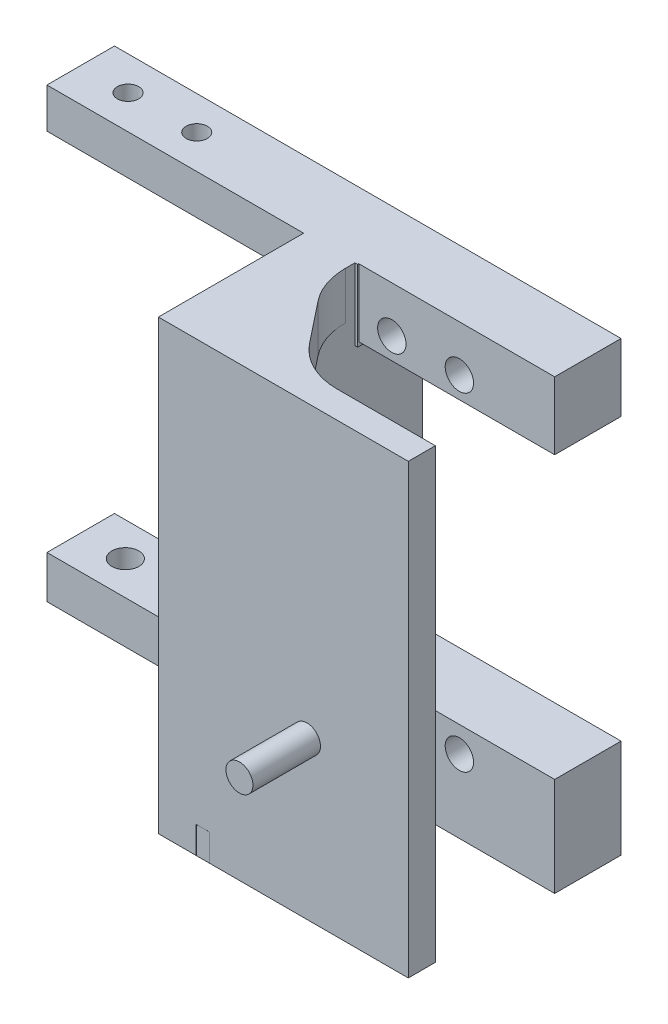
from build123d import *

# Parameters (mm, degrees)
SKETCH3_W               = 5
SKETCH3_H               = 41
SKETCH3_W_2             = 40.6
SKETCH3_H_2             = 5.921911982
SKETCH3_H_3             = 5.716066276
BOSS_EXTRUDE3_DEPTH     = 29.5
SKETCH4_W               = 38
SKETCH4_H               = 19.5
CUT_EXTRUDE1_DEPTH      = 83
SKETCH6_W               = 2
SKETCH6_H               = 62.25
BOSS_EXTRUDE4_DEPTH     = 30
CUT_EXTRUDE3_DEPTH      = 96.683171243
CUT_EXTRUDE3_DEPTH_BACK = 77
SKETCH9_W               = 24.4
SKETCH9_H               = 17.5
SKETCH10_R              = 2
BOSS_EXTRUDE5_DEPTH     = 12
CUT_EXTRUDE4_DEPTH      = 29
SKETCH12_W              = 5
SKETCH12_H              = 3.036960159
CUT_EXTRUDE5_DEPTH      = 66
SKETCH13_R              = 1.575
CUT_EXTRUDE6_DEPTH      = 20
BOSS_EXTRUDE6_DEPTH     = 7
FILLET1_R               = 10
SKETCH15_R              = 2.1
CUT_EXTRUDE7_DEPTH      = 13
SKETCH16_W              = 37
SKETCH16_H              = 62.25
BOSS_EXTRUDE7_DEPTH     = 2
BOSS_EXTRUDE8_DEPTH     = 4
SKETCH19_W              = 40.6
SKETCH19_H              = 3.403788035
CUT_EXTRUDE8_DEPTH      = 97.335783039
SKETCH20_W              = 5.557340338
SKETCH20_H              = 21.5
BOSS_EXTRUDE9_DEPTH     = 66.25
SKETCH22_R              = 2
CUT_EXTRUDE11_DEPTH     = 12


with BuildPart() as part:
    # Sketch3 → Boss-Extrude3 (new body)
    with BuildSketch(Plane.XY):
        Polygon((37.007505292, -41.485394176), (37.007505292, -0.485394176), (37.007505292, 10.139605824), (32.007505292, 10.139605824), (32.007505292, 4.217693842), (32.007505292, -46.3943279), (32.007505292, -52.110394176), (37.007505292, -52.110394176), align=None)
        with Locations((63.907505292, -20.985394176)):
            Rectangle(SKETCH3_W, SKETCH3_H)
        Polygon((61.407505292, -41.485394176), (37.007505292, -41.485394176), (37.007505292, -52.110394176), (66.407505292, -52.110394176), (66.407505292, -41.485394176), align=None)
        Polygon((37.007505292, 10.139605824), (37.007505292, -0.485394176), (61.407505292, -0.485394176), (66.407505292, -0.485394176), (66.407505292, 10.139605824), align=None)
        with Locations((11.707505292, 7.178649833)):
            Rectangle(SKETCH3_W_2, SKETCH3_H_2)
        with Locations((11.707505292, -49.252361038)):
            Rectangle(SKETCH3_W_2, SKETCH3_H_3)
    extrude(amount=BOSS_EXTRUDE3_DEPTH)

    # Sketch4 → Cut-Extrude1 (cut)
    with BuildSketch(Plane.XZ.offset(52.110394176)):
        with Locations((10.407505292, 19.75)):
            Rectangle(SKETCH4_W, SKETCH4_H)
    extrude(amount=-CUT_EXTRUDE1_DEPTH, mode=Mode.SUBTRACT)

    # Sketch6 → Boss-Extrude4 (add)
    with BuildSketch(Plane(origin=(66.407505292, 0, 0), x_dir=(0, 0, -1), z_dir=(1, 0, 0))):
        with Locations((-28.5, -20.985394176)):
            Rectangle(SKETCH6_W, SKETCH6_H)
    extrude(amount=-BOSS_EXTRUDE4_DEPTH)

    # Sketch9 → Cut-Extrude3 (cut, two sides: drawn at the far end of the back side and taken through both)
    with BuildSketch(Plane(origin=(0, -52.110394176, 0), x_dir=(-1, 0, 0), z_dir=(0, -1, 0)).offset(-CUT_EXTRUDE3_DEPTH_BACK)):
        with Locations((-49.207505292, -18.75)):
            Rectangle(SKETCH9_W, SKETCH9_H)
    extrude(amount=CUT_EXTRUDE3_DEPTH + CUT_EXTRUDE3_DEPTH_BACK, mode=Mode.SUBTRACT)

    # Sketch10 → Boss-Extrude5 (add)
    with BuildSketch(Plane.XY.offset(29.5)):
        with Locations((51.407505292, -32.900394176)):
            Circle(SKETCH10_R)
    extrude(amount=BOSS_EXTRUDE5_DEPTH)

    # Sketch11 → Cut-Extrude4 (cut)
    with BuildSketch(Plane(origin=(66.407505292, 0, 0), x_dir=(0, 0, -1), z_dir=(1, 0, 0))):
        Polygon((0, -41.485394176), (-9.829517325, -41.485394176), (-9.829517325, -52.110394176), (-24.463039841, -52.110394176), (-24.463039841, -42.110394176), (-24.463039841, 0), (-24.463039841, 10.139605824), (-9.829517325, 10.139605824), (-9.829517325, 0.139605824), (0, 0.139605824), align=None)
    extrude(amount=-CUT_EXTRUDE4_DEPTH, mode=Mode.SUBTRACT)

    # Sketch12 → Cut-Extrude5 (cut)
    with BuildSketch(Plane(origin=(0, 10.139605824, 0), x_dir=(1, 0, 0), z_dir=(0, 1, 0))):
        with Locations((63.907505292, -25.98151992)):
            Rectangle(SKETCH12_W, SKETCH12_H)
    extrude(amount=-CUT_EXTRUDE5_DEPTH, mode=Mode.SUBTRACT)

    # Sketch13 → Cut-Extrude6 (cut)
    with BuildSketch(Plane(origin=(0, 10.139605824, 0), x_dir=(1, 0, 0), z_dir=(0, 1, 0))):
        with Locations(Location((-1.592494708, -4.992044142, 0), (0, 0, 180))):
            Circle(SKETCH13_R)
        with Locations(Location((8.567505292, -4.980496782, 0), (0, 0, 180))):
            Circle(SKETCH13_R)
    extrude(amount=-CUT_EXTRUDE6_DEPTH, mode=Mode.SUBTRACT)

    # Sketch14 → Boss-Extrude6 (add)
    with BuildSketch(Plane(origin=(0, 10.139605824, 0), x_dir=(1, 0, 0), z_dir=(0, 1, 0))):
        Polygon((47.007505292, -27.5), (37.007505292, -14.894614106), (37.007505292, -27.5), align=None)
    extrude(amount=-BOSS_EXTRUDE6_DEPTH)

    # Fillet1
    fillet1_edges = [part.edges().sort_by_distance(p)[0] for p in [
        (47.007505292, 6.639605824, 27.5),
        (37.007505292, 6.639605824, 14.894614106),
    ]]
    fillet(fillet1_edges, radius=FILLET1_R)

    # Sketch15 → Cut-Extrude7 (cut)
    with BuildSketch(Plane(origin=(0, 0, 0), x_dir=(-1, 0, 0), z_dir=(0, 0, -1))):
        with Locations((-42.297505292, -45.285394176)):
            Circle(SKETCH15_R)
        with Locations((-52.297505292, -45.285394176)):
            Circle(SKETCH15_R)
        with Locations((-42.297505292, 3.314605824)):
            Circle(SKETCH15_R)
        with Locations((-52.297505292, 3.314605824)):
            Circle(SKETCH15_R)
    extrude(amount=-CUT_EXTRUDE7_DEPTH, mode=Mode.SUBTRACT)

    # Sketch16 → Boss-Extrude7 (add)
    with BuildSketch(Plane.XY.offset(29.5)):
        with Locations((47.907505292, -20.985394176)):
            Rectangle(SKETCH16_W, SKETCH16_H)
    extrude(amount=BOSS_EXTRUDE7_DEPTH)

    # Sketch17 → Boss-Extrude8 (add)
    with BuildSketch(Plane.XZ.offset(52.110394176)):
        Polygon((-8.592494708, 0), (66.407505292, 0), (66.407505292, 9.829517325), (37.407505292, 9.829517325), (37.407505292, 10), (37.007505292, 10), (37.007505292, 27.5), (66.407505292, 27.5), (66.407505292, 31.5), (37.007505292, 31.5), (37.007505292, 31.503473539), (35.075655428, 31.503473539), (35.075655428, 10), (-8.592494708, 10), align=None)
    extrude(amount=BOSS_EXTRUDE8_DEPTH)

    # Sketch19 → Cut-Extrude8 (cut, through all)
    with BuildSketch(Plane(origin=(0, 0, 0), x_dir=(-1, 0, 0), z_dir=(0, 0, -1))):
        with Locations((-11.707505292, -48.096221918)):
            Rectangle(SKETCH19_W, SKETCH19_H)
    extrude(amount=-CUT_EXTRUDE8_DEPTH, mode=Mode.SUBTRACT)

    # Sketch20 → Boss-Extrude9 (add)
    with BuildSketch(Plane(origin=(0, 10.139605824, 0), x_dir=(1, 0, 0), z_dir=(0, 1, 0))):
        with Locations((32.186175461, -20.75)):
            Rectangle(SKETCH20_W, SKETCH20_H)
    extrude(amount=-BOSS_EXTRUDE9_DEPTH)

    # Sketch22 → Cut-Extrude11 (cut)
    with BuildSketch(Plane.XZ.offset(56.110394176)):
        with Locations(Location((-1.992494708, 4.992044142, 0), (0, 0, 270))):
            Circle(SKETCH22_R)
    extrude(amount=-CUT_EXTRUDE11_DEPTH, mode=Mode.SUBTRACT)


solid = part.part
